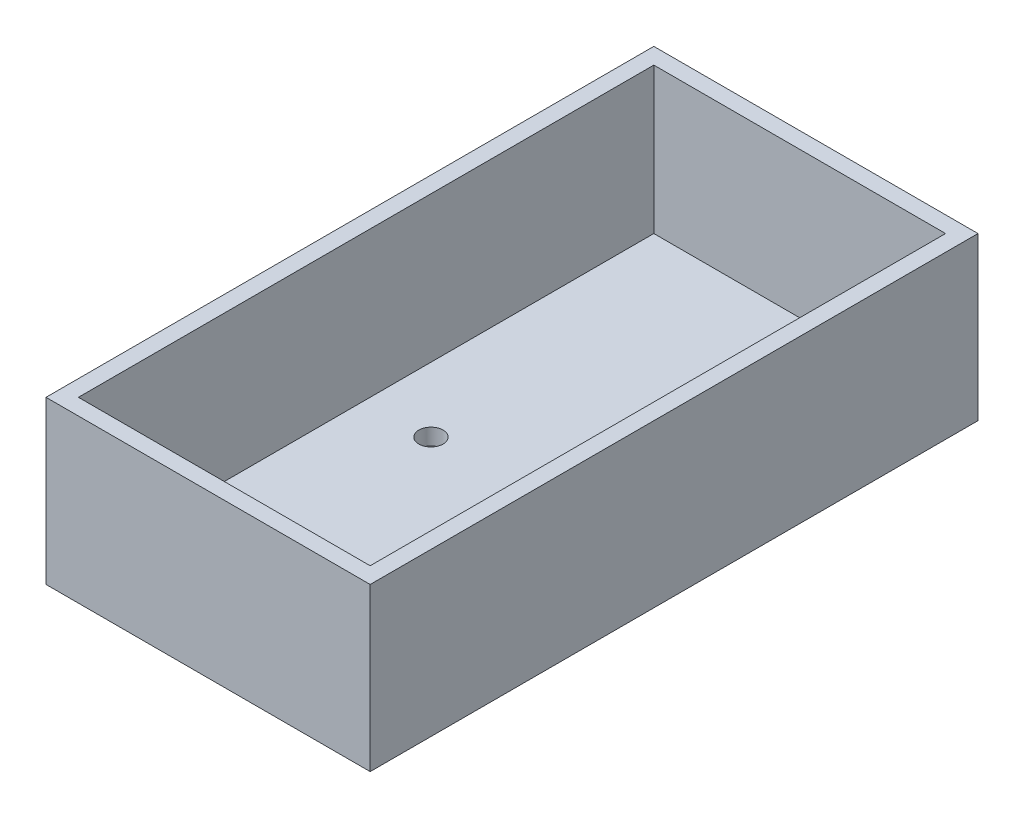
from build123d import *

# Parameters (mm, degrees)
SKETCH_1_W              = 40
SKETCH_1_H              = 75
EXTRUDE_1_DEPTH         = 20
SKETCH_2_W              = 36
SKETCH_2_H              = 71
CUT_EXTRUDE_1_DEPTH     = 18
CUT_EXTRUDE4_DEPTH      = 47.97073557
CUT_EXTRUDE4_DEPTH_BACK = 47.97073557
SKETCH1_R               = 1.5


with BuildPart() as part:
    # 스케치1 → 보스-돌출1 (new body)
    with BuildSketch(Plane(origin=(0, 0, 0), x_dir=(1, 0, 0), z_dir=(0, 1, 0))):
        Rectangle(SKETCH_1_W, SKETCH_1_H)
    extrude(amount=EXTRUDE_1_DEPTH)

    # 스케치2 → 컷-돌출1 (cut)
    with BuildSketch(Plane(origin=(0, 20, 0), x_dir=(1, 0, 0), z_dir=(0, 1, 0))):
        Rectangle(SKETCH_2_W, SKETCH_2_H)
    extrude(amount=-CUT_EXTRUDE_1_DEPTH, mode=Mode.SUBTRACT)

    # Sketch1 → Cut-Extrude4 (cut, two sides: drawn at the far end of the back side and taken through both)
    with BuildSketch(Plane(origin=(0, 0, 0), x_dir=(1, 0, 0), z_dir=(0, 1, 0)).offset(-CUT_EXTRUDE4_DEPTH_BACK)):
        with Locations(Location((-10, 0, 0), (0, 0, 270))):
            Circle(SKETCH1_R)
        with Locations(Location((10, 0, 0), (0, 0, 270))):
            Circle(SKETCH1_R)
    extrude(amount=CUT_EXTRUDE4_DEPTH + CUT_EXTRUDE4_DEPTH_BACK, mode=Mode.SUBTRACT)


solid = part.part
